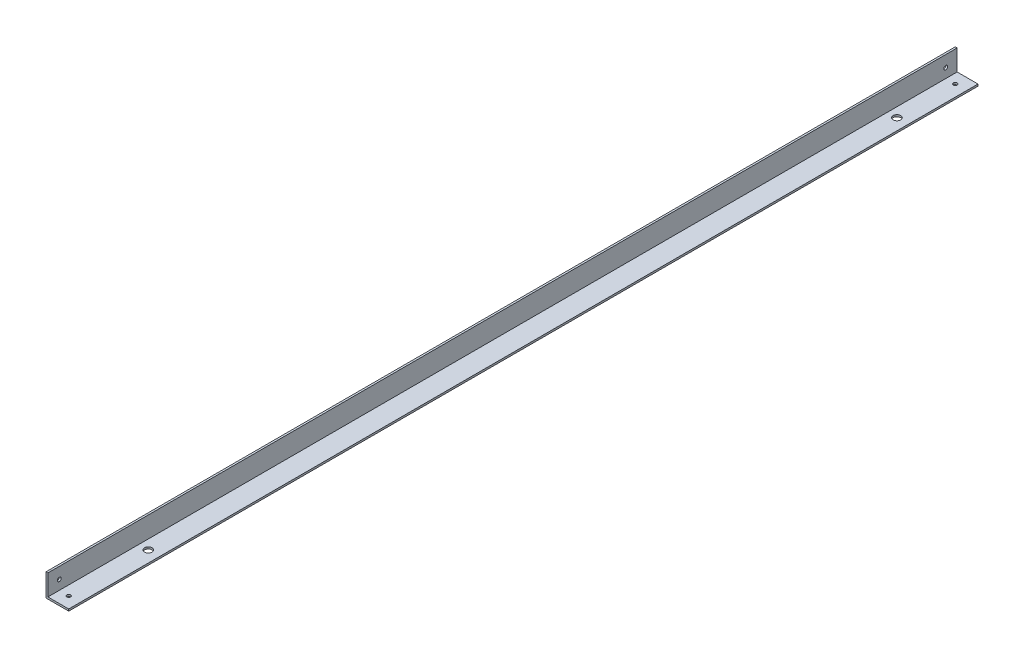
from build123d import *

# Parameters (mm, degrees)
BOSS_EXTRUDE1_DEPTH = 762
SKETCH2_R           = 1.5875
SKETCH2_R_2         = 3.175
CUT_EXTRUDE2_DEPTH  = 2.794
SKETCH4_R           = 1.5875
CUT_EXTRUDE3_DEPTH  = 8.89
SKETCH5_OUTSIDE_W   = 192.738
SKETCH5_OUTSIDE_H   = 173.688
SKETCH5_OUTSIDE_W_2 = 19.05
SKETCH5_OUTSIDE_H_2 = 19.05
CUT_EXTRUDE4_DEPTH  = 764.189696275


with BuildPart() as part:
    # Sketch1 → Boss-Extrude1 (new body)
    with BuildSketch(Plane.XY):
        Polygon((0, 0), (0, 19.05), (1.5875, 19.05), (1.5875, 1.5875), (19.05, 1.5875), (19.05, 0), align=None)
    boss_extrude1 = extrude(amount=-BOSS_EXTRUDE1_DEPTH)

    # Sketch2 → Cut-Extrude2 (cut)
    with BuildSketch(Plane(origin=(0, 1.5875, 0), x_dir=(1, 0, 0), z_dir=(0, 1, 0))):
        with Locations((9.525, 9.525)):
            Circle(SKETCH2_R)
        with Locations((9.525, 752.475)):
            Circle(SKETCH2_R)
        with Locations((9.525, 76.2)):
            Circle(SKETCH2_R_2)
        with Locations((9.525, 703.58)):
            Circle(SKETCH2_R_2)
    cut_extrude2 = extrude(amount=-CUT_EXTRUDE2_DEPTH, mode=Mode.SUBTRACT)

    # Sketch4 → Cut-Extrude3 (cut)
    with BuildSketch(Plane(origin=(1.5875, 0, 0), x_dir=(0, 0, -1), z_dir=(1, 0, 0))):
        with Locations((9.525, 9.525)):
            Circle(SKETCH4_R)
        with Locations((752.475, 9.525)):
            Circle(SKETCH4_R)
    cut_extrude3 = extrude(amount=-CUT_EXTRUDE3_DEPTH, mode=Mode.SUBTRACT)

    # Mirror1: Boss-Extrude1, Cut-Extrude2, Cut-Extrude3 across plane
    add(boss_extrude1.mirror(Plane(origin=(19.05, 0, -762), x_dir=(0, 0, 1), z_dir=(1, 0, 0))))
    add(cut_extrude2.mirror(Plane(origin=(19.05, 0, -762), x_dir=(0, 0, 1), z_dir=(1, 0, 0))), mode=Mode.SUBTRACT)
    add(cut_extrude3.mirror(Plane(origin=(19.05, 0, -762), x_dir=(0, 0, 1), z_dir=(1, 0, 0))), mode=Mode.SUBTRACT)

    # Sketch5 outside → Cut-Extrude4 (cut, through all)
    with BuildSketch(Plane.XY):
        with Locations((19.05, 9.525)):
            Rectangle(SKETCH5_OUTSIDE_W, SKETCH5_OUTSIDE_H)
        with Locations((9.525, 9.525)):
            Rectangle(SKETCH5_OUTSIDE_W_2, SKETCH5_OUTSIDE_H_2, mode=Mode.SUBTRACT)
    extrude(amount=-CUT_EXTRUDE4_DEPTH, mode=Mode.SUBTRACT)


solid = part.part
